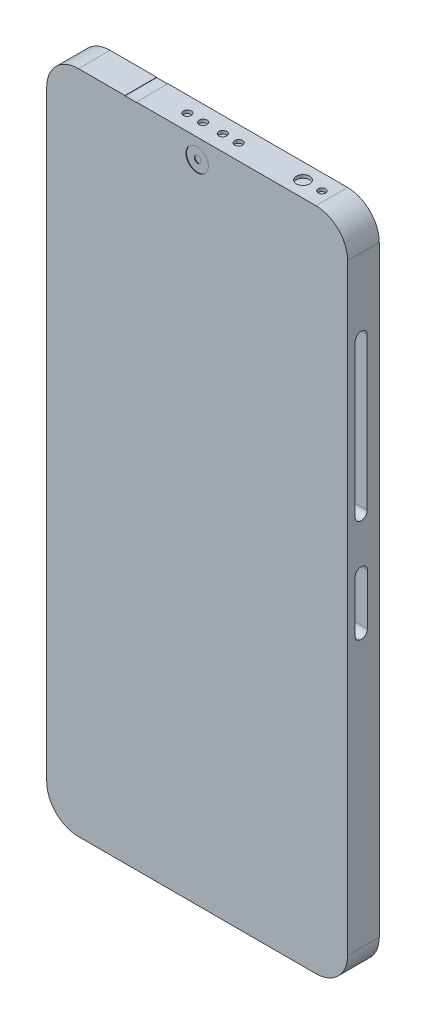
from build123d import *

# Parameters (mm, degrees)
EXTRUDE_2_DEPTH      = 10
SKETCH_10_R          = 1.25
SKETCH_10_R_2        = 2.1
SKETCH_10_R_3        = 1.15
CUT_EXTRUDE_3_DEPTH  = 1
CUT_EXTRUDE_4_DEPTH  = 20.085810478
SKETCH_16_R          = 1.45
SKETCH_16_R_2        = 2.328282895
CUT_EXTRUDE_6_DEPTH  = 10
SKETCH_18_R          = 0.54507581
CUT_EXTRUDE_7_DEPTH  = 10
CUT_EXTRUDE_8_DEPTH  = 8
SKETCH_22_R          = 3.550641332
CUT_EXTRUDE_9_DEPTH  = 0.2
SKETCH_23_R          = 1.070824202
CUT_EXTRUDE_10_DEPTH = 0.2
CUT_EXTRUDE_11_DEPTH = 0.1
SKETCH_8_W           = 3.574817698
SKETCH_8_H           = 10
CUT_EXTRUDE_13_DEPTH = 0.1


with BuildPart() as part:
    # 草图1 → 凸台-拉伸2 (new body)
    with BuildSketch(Plane.XY):
        with BuildLine():
            Line((-37.5, 105), (37.5, 105))
            ThreePointArc((37.5, 105), (44.571067812, 102.071067812), (47.5, 95))
            Line((47.5, 95), (47.5, -95))
            ThreePointArc((47.5, -95), (44.571067812, -102.071067812), (37.5, -105))
            Line((37.5, -105), (-37.5, -105))
            ThreePointArc((-37.5, -105), (-44.571067812, -102.071067812), (-47.5, -95))
            Line((-47.5, -95), (-47.5, 95))
            ThreePointArc((-47.5, 95), (-44.571067812, 102.071067812), (-37.5, 105))
        make_face()
    extrude(amount=EXTRUDE_2_DEPTH)

    # 草图10 → 切除-拉伸3 (cut)
    with BuildSketch(Plane(origin=(0, 105, 0), x_dir=(1, 0, 0), z_dir=(0, 1, 0))):
        with Locations(Location((-3.103218147, -5, 0), (0, 0, 270))):
            Circle(SKETCH_10_R)
        with Locations(Location((-8.103218147, -5, 0), (0, 0, 270))):
            Circle(SKETCH_10_R)
        with Locations(Location((8.103218147, -5, 0), (0, 0, 90))):
            Circle(SKETCH_10_R)
        with Locations(Location((3.103218147, -5, 0), (0, 0, 90))):
            Circle(SKETCH_10_R)
        with Locations(Location((28.429371283, -5, 0), (0, 0, 270))):
            Circle(SKETCH_10_R_2)
        with Locations(Location((34.368889588, -5, 0), (0, 0, 270))):
            Circle(SKETCH_10_R_3)
    extrude(amount=-CUT_EXTRUDE_3_DEPTH, mode=Mode.SUBTRACT)

    # 草图14 → 切除-拉伸4 (cut)
    with BuildSketch(Plane.XZ.offset(105)):
        with BuildLine():
            Line((-4.965024582, 8.276916224), (4.834975418, 8.276916224))
            ThreePointArc((4.834975418, 8.276916224), (8.211192134, 4.900699508), (4.834975418, 1.524482793))
            Line((4.834975418, 1.524482793), (-4.965024582, 1.524482793))
            ThreePointArc((-4.965024582, 1.524482793), (-8.341241297, 4.900699508), (-4.965024582, 8.276916224))
        make_face()
    extrude(amount=-CUT_EXTRUDE_4_DEPTH, mode=Mode.SUBTRACT)

    # 草图16 → 切除-拉伸6 (cut)
    with BuildSketch(Plane.XZ.offset(105)):
        with Locations(Location((-14.907323762, 5.165500819, 0), (0, 0, 270))):
            Circle(SKETCH_16_R)
        with Locations(Location((14.729603626, 5.165500819, 0), (0, 0, 270))):
            Circle(SKETCH_16_R_2)
        with Locations(Location((19.729603626, 5.165500819, 0), (0, 0, 270))):
            Circle(SKETCH_16_R_2)
        with Locations(Location((24.729603626, 5.165500819, 0), (0, 0, 270))):
            Circle(SKETCH_16_R_2)
        with Locations(Location((29.729603626, 5.165500819, 0), (0, 0, 270))):
            Circle(SKETCH_16_R_2)
        with Locations(Location((34.729603626, 5.165500819, 0), (0, 0, 270))):
            Circle(SKETCH_16_R_2)
    extrude(amount=-CUT_EXTRUDE_6_DEPTH, mode=Mode.SUBTRACT)

    # 草图18 → 切除-拉伸7 (cut)
    with BuildSketch(Plane.XZ.offset(105)):
        with Locations(Location((-34.978222052, 4.882313786, 0), (0, 0, 270))):
            Circle(SKETCH_18_R)
    extrude(amount=-CUT_EXTRUDE_7_DEPTH, mode=Mode.SUBTRACT)

    # 草图21 → 切除-拉伸8 (cut)
    with BuildSketch(Plane(origin=(47.5, 0, 0), x_dir=(0, 0, -1), z_dir=(1, 0, 0))):
        with BuildLine():
            Line((-3.80943092, 71.612022187), (-3.80943092, 23.612022187))
            ThreePointArc((-3.80943092, 23.612022187), (-5.70879523, 21.712657877), (-7.60815954, 23.612022187))
            Line((-7.60815954, 23.612022187), (-7.60815954, 71.612022187))
            ThreePointArc((-7.60815954, 71.612022187), (-5.70879523, 73.511386497), (-3.80943092, 71.612022187))
        make_face()
        with BuildLine():
            Line((-3.753848509, 7.202317814), (-3.753848509, -8.787308396))
            ThreePointArc((-3.753848509, -8.787308396), (-5.70879523, -10.742255117), (-7.663741952, -8.787308396))
            Line((-7.663741952, -8.787308396), (-7.663741952, 7.202317814))
            ThreePointArc((-7.663741952, 7.202317814), (-5.70879523, 9.157264535), (-3.753848509, 7.202317814))
        make_face()
    extrude(amount=-CUT_EXTRUDE_8_DEPTH, mode=Mode.SUBTRACT)

    # 草图22 → 切除-拉伸9 (cut)
    with BuildSketch(Plane.XY.offset(10)):
        with Locations((0, 98.825967342)):
            Circle(SKETCH_22_R)
    extrude(amount=-CUT_EXTRUDE_9_DEPTH, mode=Mode.SUBTRACT)

    # 草图23 → 切除-拉伸10 (cut)
    with BuildSketch(Plane.XY.offset(9.8)):
        with Locations((0, 98.825967342)):
            Circle(SKETCH_23_R)
    extrude(amount=-CUT_EXTRUDE_10_DEPTH, mode=Mode.SUBTRACT)

    # 草图19 → 切除-拉伸11 (cut)
    with BuildSketch(Plane.XZ.offset(105)):
        with BuildLine():
            Line((-34.978222052, 7.064787425), (-21.832097418, 7.064787425))
            ThreePointArc((-21.832097418, 7.064787425), (-19.64962378, 4.882313786), (-21.832097418, 2.699840148))
            Line((-21.832097418, 2.699840148), (-34.978222052, 2.699840148))
            ThreePointArc((-34.978222052, 2.699840148), (-37.160695691, 4.882313786), (-34.978222052, 7.064787425))
        make_face()
    extrude(amount=-CUT_EXTRUDE_11_DEPTH, mode=Mode.SUBTRACT)

    # 草图8 → 切除-拉伸13 (cut)
    with BuildSketch(Plane(origin=(0, 105, 0), x_dir=(1, 0, 0), z_dir=(0, 1, 0))):
        with Locations((-21, -5)):
            Rectangle(SKETCH_8_W, SKETCH_8_H)
    extrude(amount=-CUT_EXTRUDE_13_DEPTH, mode=Mode.SUBTRACT)


solid = part.part
